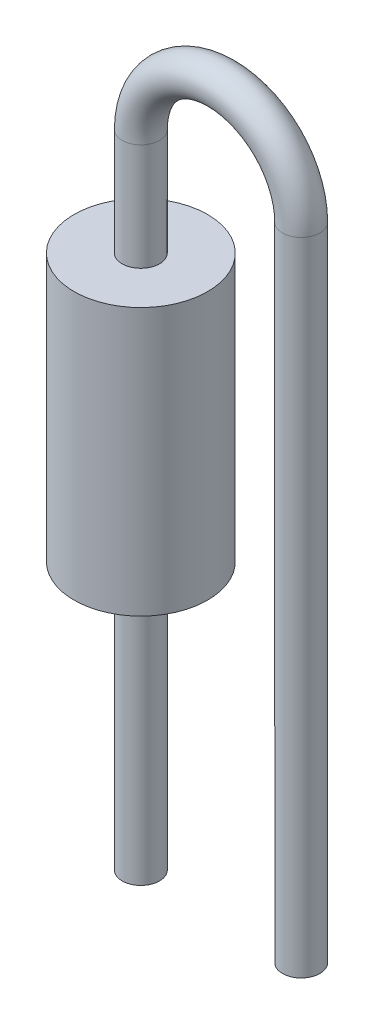
from build123d import *

# Parameters (mm, degrees)
SKETCH_2_R      = 0.35
SKETCH_3_R      = 1.25
EXTRUDE_1_DEPTH = 5


with BuildPart() as part:
    # По траектории1: sweep along a path in Эскиз1
    with BuildLine(Plane.XY) as sweep_1_path:
        Line((0, 0), (0, 12))
        ThreePointArc((0, 12), (1.5, 13.5), (3, 12))
        Line((3, 12), (3, 0))
    # Эскиз2 → По траектории1 (sweep)
    with BuildSketch(Plane(origin=(0, 0, 0), x_dir=(1, 0, 0), z_dir=(0, 1, 0))):
        Circle(SKETCH_2_R)
    sweep(path=sweep_1_path.line)

    # Эскиз3 → Вытянуть1 (add)
    with BuildSketch(Plane.XZ.offset(-5)):
        with Locations(Location((0, 0, 0), (0, 0, 270))):
            Circle(SKETCH_3_R)
    extrude(amount=-EXTRUDE_1_DEPTH)


solid = part.part
